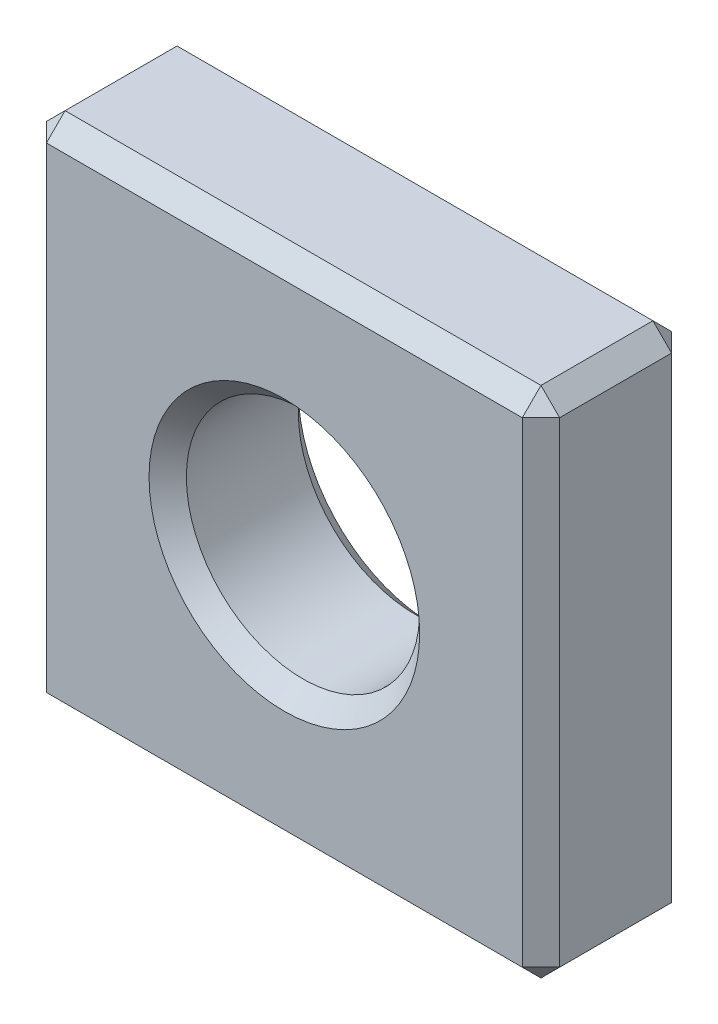
from build123d import *

# Parameters (mm, degrees)
SKETCH1_W           = 5.5
SKETCH1_H           = 5.5
SKETCH1_R           = 1.25
BOSS_EXTRUDE1_DEPTH = 1.6
CHAMFER1_SIZE       = 0.2


with BuildPart() as part:
    # Sketch1 → Boss-Extrude1 (new body)
    with BuildSketch(Plane.XY):
        Rectangle(SKETCH1_W, SKETCH1_H)
        Circle(SKETCH1_R, mode=Mode.SUBTRACT)
    extrude(amount=BOSS_EXTRUDE1_DEPTH)

    # Chamfer1
    chamfer1_edges = [part.edges().sort_by_distance(p)[0] for p in [
        (-2.75, 0, 1.6),
        (-1.25, 0, 0),
        (-1.25, 0, 1.6),
        (0, -2.75, 1.6),
        (2.75, 0, 1.6),
        (0, -2.75, 0),
        (-2.75, 0, 0),
        (0, 2.75, 0),
        (2.75, 0, 0),
        (0, 2.75, 1.6),
        (2.75, -2.75, 0.8),
        (-2.75, -2.75, 0.8),
        (-2.75, 2.75, 0.8),
        (2.75, 2.75, 0.8),
    ]]
    chamfer(chamfer1_edges, length=CHAMFER1_SIZE)


solid = part.part
